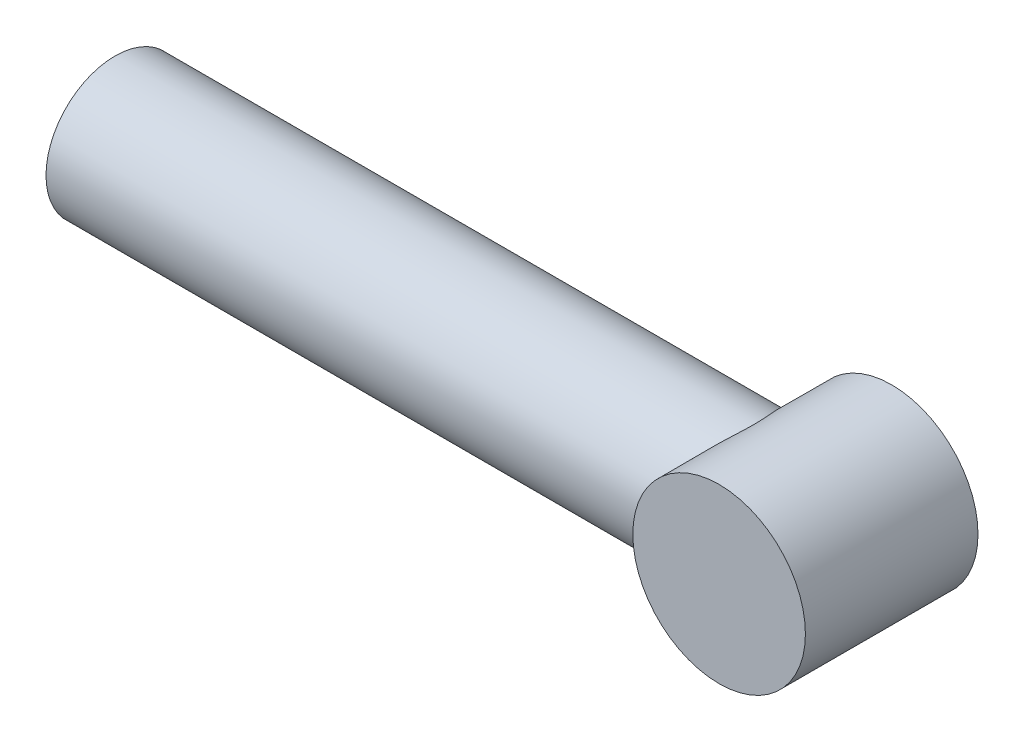
from build123d import *

# Parameters (mm, degrees)
SKETCH_1_R      = 40
EXTRUDE_1_DEPTH = 200
SKETCH_2_R      = 50
EXTRUDE_2_DEPTH = 50


with BuildPart() as part:
    # 草图1 → 凸台-拉伸1 (new, symmetric)
    with BuildSketch(Plane(origin=(0, 0, 0), x_dir=(0, 0, -1), z_dir=(1, 0, 0))):
        Circle(SKETCH_1_R)
    extrude(amount=EXTRUDE_1_DEPTH, both=True)

    # 草图2 → 凸台-拉伸2 (add, symmetric)
    with BuildSketch(Plane.XY):
        with Locations((200, 0)):
            Circle(SKETCH_2_R)
    extrude(amount=EXTRUDE_2_DEPTH, both=True)


solid = part.part
